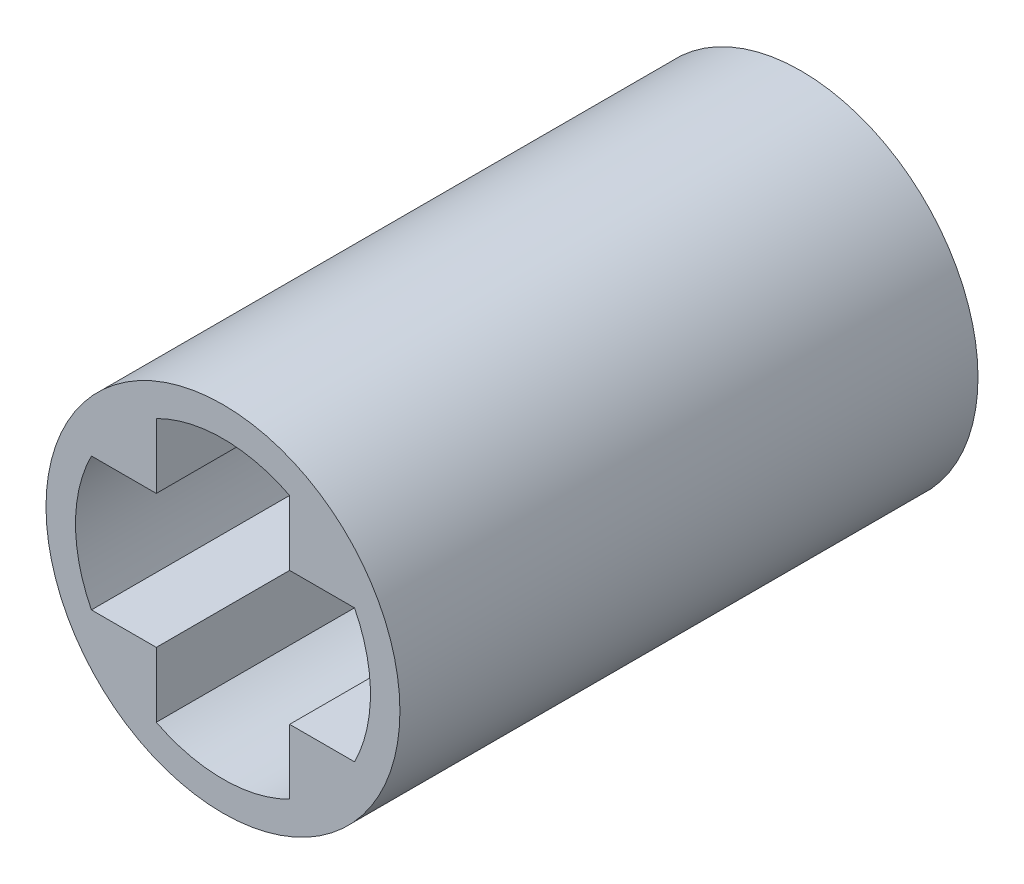
from build123d import *

# Parameters (mm, degrees)
SKETCH_1_R               = 3
SKETCH_1_R_2             = 1.40625
EXTRUDE_1_DEPTH          = 5
CUT_EXTRUDE_2_DEPTH      = 7.557438524
PATTERN_CIRCULAR_1_COUNT = 7
SKETCH_2_R               = 3
EXTRUDE_2_DEPTH          = 4.8
CUT_EXTRUDE_START        = 4.8
CUT_EXTRUDE_3_DEPTH      = 3.8


with BuildPart() as part:
    # 草图1 → 凸台-拉伸1 (new body)
    with BuildSketch(Plane.XY):
        Circle(SKETCH_1_R)
        Circle(SKETCH_1_R_2, mode=Mode.SUBTRACT)
    extrude(amount=EXTRUDE_1_DEPTH)

    # 草图1<3> → 切除-拉伸2 (cut, through all)
    with BuildSketch(Plane.XY):
        with BuildLine():
            Line((1.546319716, 0.559598866), (1.322324253, 0.478536971))
            ThreePointArc((1.322324253, 0.478536971), (1.385109661, 0.242920339), (1.40625, 0))
            ThreePointArc((1.40625, 0), (1.385109661, -0.242920339), (1.322324253, -0.478536971))
            Line((1.322324253, -0.478536971), (1.546319716, -0.559598866))
            add(Edge.make_bspline(
                [(1.546319716, -0.559598866), (1.558105463, -0.563864019), (1.591921474, -0.573215837), (1.658734166, -0.580959295), (1.767731952, -0.57845396), (1.907008009, -0.553308364), (2.079413065, -0.496026363), (2.261035814, -0.40341458), (2.393734523, -0.311147352), (2.48335867, -0.236539754), (2.523284743, -0.200650618)],
                knots=[0, 0, 0, 0, 0, 0.005604068, 0.015718248, 0.029959916, 0.048733667, 0.068727063, 0.096888892, 0.120945025, 0.120945025, 0.120945025, 0.120945025, 0.120945025], degree=4))
            ThreePointArc((2.523284743, -0.200650618), (2.529257902, -0.100404327), (2.53125, 0))
            ThreePointArc((2.53125, 0), (2.529257902, 0.100404327), (2.523284743, 0.200650618))
            add(Edge.make_bspline(
                [(1.546319716, 0.559598866), (1.558105463, 0.563864019), (1.591921474, 0.573215837), (1.658734166, 0.580959295), (1.767731952, 0.57845396), (1.907008009, 0.553308364), (2.079413065, 0.496026363), (2.261035814, 0.40341458), (2.393734523, 0.311147352), (2.48335867, 0.236539754), (2.523284743, 0.200650618)],
                knots=[0, 0, 0, 0, 0, 0.005604068, 0.015718248, 0.029959916, 0.048733667, 0.068727063, 0.096888892, 0.120945025, 0.120945025, 0.120945025, 0.120945025, 0.120945025], degree=4))
        make_face()
    cut_extrude_2 = extrude(amount=CUT_EXTRUDE_2_DEPTH, mode=Mode.SUBTRACT)

    # 阵列(圆周)1: 切除-拉伸2 ×7 about axis
    pattern_circular_1_axis = Axis((0, 0, 5), (0, 0, 1))
    for i in range(1, PATTERN_CIRCULAR_1_COUNT):
        add(cut_extrude_2.rotate(pattern_circular_1_axis, i * 360 / PATTERN_CIRCULAR_1_COUNT), mode=Mode.SUBTRACT)

    # 草图2 → 凸台-拉伸2 (add)
    with BuildSketch(Plane.XY.offset(5)):
        Circle(SKETCH_2_R)
    extrude(amount=EXTRUDE_2_DEPTH)

    # 草图2<4> → 切除-拉伸3 (cut)
    with BuildSketch(Plane.XY.offset(5).offset(CUT_EXTRUDE_START)):
        with BuildLine():
            ThreePointArc((1.130029762, 2.230029762), (0, 2.5), (-1.130029762, 2.230029762))
            Line((-1.130029762, 2.230029762), (-1.130029762, 1.130029762))
            Line((-1.130029762, 1.130029762), (-2.230029762, 1.130029762))
            ThreePointArc((-2.230029762, 1.130029762), (-2.5, 0), (-2.230029762, -1.130029762))
            Line((-2.230029762, -1.130029762), (-1.130029762, -1.130029762))
            Line((-1.130029762, -1.130029762), (-1.130029762, -2.230029762))
            ThreePointArc((-1.130029762, -2.230029762), (0, -2.5), (1.130029762, -2.230029762))
            Line((1.130029762, -2.230029762), (1.130029762, -1.130029762))
            Line((1.130029762, -1.130029762), (2.230029762, -1.130029762))
            ThreePointArc((2.230029762, -1.130029762), (2.5, 0), (2.230029762, 1.130029762))
            Line((2.230029762, 1.130029762), (1.130029762, 1.130029762))
            Line((1.130029762, 1.130029762), (1.130029762, 2.230029762))
        make_face()
    extrude(amount=-CUT_EXTRUDE_3_DEPTH, mode=Mode.SUBTRACT)


solid = part.part
